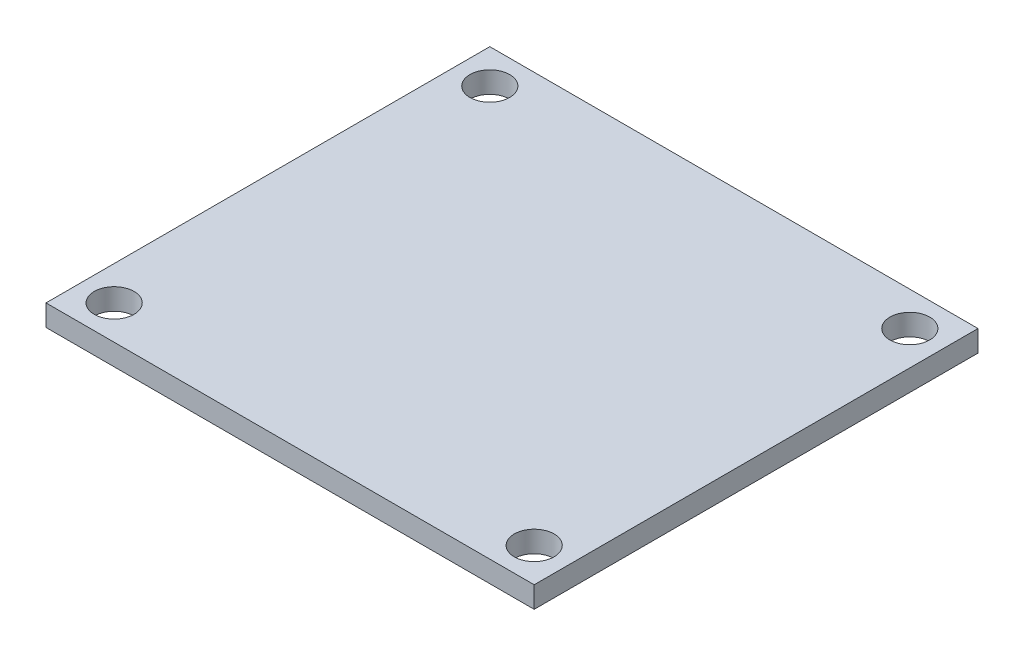
from build123d import *

# Parameters (mm, degrees)
SKETCH1_W           = 34.925
SKETCH1_H           = 31.75
SKETCH1_R           = 1.4224
BOSS_EXTRUDE1_DEPTH = 1.524


with BuildPart() as part:
    # Sketch1 → Boss-Extrude1 (new body)
    with BuildSketch(Plane(origin=(0, 0, 0), x_dir=(1, 0, 0), z_dir=(0, 1, 0))):
        with Locations((-2.269138418, 1.973163842)):
            Rectangle(SKETCH1_W, SKETCH1_H)
        with Locations(Location((-17.293238418, 15.409763842, 0), (0, 0, 90))):
            Circle(SKETCH1_R, mode=Mode.SUBTRACT)
        with Locations(Location((12.754961582, 15.409763842, 0), (0, 0, 90))):
            Circle(SKETCH1_R, mode=Mode.SUBTRACT)
        with Locations(Location((12.754961582, -11.463436158, 0), (0, 0, 90))):
            Circle(SKETCH1_R, mode=Mode.SUBTRACT)
        with Locations(Location((-17.293238418, -11.463436158, 0), (0, 0, 90))):
            Circle(SKETCH1_R, mode=Mode.SUBTRACT)
    extrude(amount=BOSS_EXTRUDE1_DEPTH)


solid = part.part
